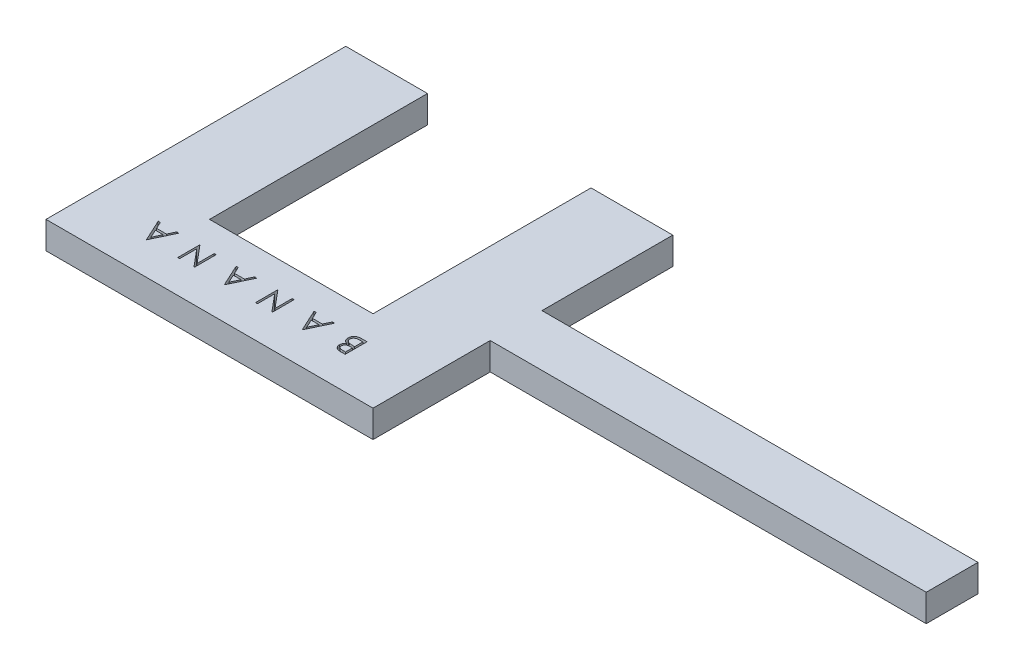
from build123d import *

# Parameters (mm, degrees)
BOSS_EXTRUDE1_DEPTH = 5
CUT_EXTRUDE1_DEPTH  = 3


with BuildPart() as part:
    # Sketch1 → Boss-Extrude1 (new body)
    with BuildSketch(Plane(origin=(0, 0, 0), x_dir=(1, 0, 0), z_dir=(0, 1, 0))):
        Polygon((0, -55), (60, -55), (60, -33.5), (140, -33.5), (140, -24), (60, -24), (60, 0), (45, 0), (45, -40), (15, -40), (15, 0), (0, 0), align=None)
    extrude(amount=BOSS_EXTRUDE1_DEPTH)

    # Sketch4 → Cut-Extrude1 (cut)
    # profile 1 of 6: a face of its own
    with BuildSketch(Plane(origin=(0, 5, 0), x_dir=(1, 0, 0), z_dir=(0, 1, 0))):
        Polygon((12.435897436, -49), (10.58974359, -45), (10.979967949, -45), (11.571314103, -46.282051282), (13.384615385, -46.282051282), (13.992788462, -45), (14.384615385, -45), (12.487179487, -49), align=None)
        Polygon((12.465544872, -48.220352564), (13.189903846, -46.692307692), (11.760416667, -46.692307692), align=None, mode=Mode.SUBTRACT)
    # profile 2 of 6: a face of its own
    with BuildSketch(Plane(origin=(0, 5, 0), x_dir=(1, 0, 0), z_dir=(0, 1, 0))):
        Polygon((21.225641026, -45), (21.225641026, -49), (21.150320513, -49), (18.507692308, -45.851762821), (18.507692308, -49), (18.148717949, -49), (18.148717949, -45), (18.230448718, -45), (20.866666667, -48.141025641), (20.866666667, -45), align=None)
    # profile 3 of 6: a face of its own
    with BuildSketch(Plane(origin=(0, 5, 0), x_dir=(1, 0, 0), z_dir=(0, 1, 0))):
        Polygon((26.733333333, -49), (24.887179487, -45), (25.277403846, -45), (25.86875, -46.282051282), (27.682051282, -46.282051282), (28.290224359, -45), (28.682051282, -45), (26.784615385, -49), align=None)
        Polygon((26.762980769, -48.220352564), (27.487339744, -46.692307692), (26.057852564, -46.692307692), align=None, mode=Mode.SUBTRACT)
    # profile 4 of 6: a face of its own
    with BuildSketch(Plane(origin=(0, 5, 0), x_dir=(1, 0, 0), z_dir=(0, 1, 0))):
        Polygon((35.523076923, -45), (35.523076923, -49), (35.44775641, -49), (32.805128205, -45.851762821), (32.805128205, -49), (32.446153846, -49), (32.446153846, -45), (32.527884615, -45), (35.164102564, -48.141025641), (35.164102564, -45), align=None)
    # profile 5 of 6: a face of its own
    with BuildSketch(Plane(origin=(0, 5, 0), x_dir=(1, 0, 0), z_dir=(0, 1, 0))):
        Polygon((41.030769231, -49), (39.184615385, -45), (39.574839744, -45), (40.166185897, -46.282051282), (41.979487179, -46.282051282), (42.587660256, -45), (42.979487179, -45), (41.082051282, -49), align=None)
        Polygon((41.060416667, -48.220352564), (41.784775641, -46.692307692), (40.355288462, -46.692307692), align=None, mode=Mode.SUBTRACT)
    # profile 6 of 6: a face of its own
    with BuildSketch(Plane(origin=(0, 5, 0), x_dir=(1, 0, 0), z_dir=(0, 1, 0))):
        with BuildLine():
            Line((48.897435897, -49), (48.116987179, -49))
            add(Edge.make_bspline(
                [(48.116987179, -49), (48.078782602, -48.999802304), (48.004732622, -48.999419121), (47.897061448, -48.993338284), (47.7961773, -48.985254385), (47.702258451, -48.97169408), (47.614693787, -48.957633832), (47.534372273, -48.936996754), (47.460621116, -48.91420235), (47.372061071, -48.879130066), (47.271577566, -48.824662366), (47.163576599, -48.743881592), (47.06969557, -48.647031967), (46.989868866, -48.536664179), (46.925806239, -48.415247106), (46.880046085, -48.285393075), (46.85064802, -48.149286724), (46.847662619, -48.055973237), (46.846153846, -48.008814103)],
                knots=[0, 0, 0, 0, 1.00128172, 1.940733171, 2.826250472, 3.653024905, 4.427672124, 5.149348099, 5.824709082, 6.450061444, 7.643590664, 8.808605388, 9.972104426, 11.165284501, 12.367876273, 13.557044126, 14.765369432, 16, 16, 16, 16], degree=3))
            add(Edge.make_bspline(
                [(46.846153846, -48.008814103), (46.847386233, -47.964634112), (46.84980799, -47.877816264), (46.873466598, -47.751260803), (46.909178693, -47.630411683), (46.960713415, -47.516433521), (47.026424516, -47.410327841), (47.106371945, -47.313904536), (47.201167683, -47.22905671), (47.272340847, -47.181837688), (47.30849359, -47.157852564)],
                knots=[0, 0, 0, 0, 1.044356178, 2.052258378, 3.035953355, 4.020338374, 5.002448483, 5.980768927, 6.974322109, 8, 8, 8, 8], degree=3))
            add(Edge.make_bspline(
                [(47.30849359, -47.157852564), (47.263049876, -47.140414673), (47.176104795, -47.107051668), (47.056302302, -47.047837808), (46.953049503, -46.983927334), (46.86501575, -46.9148518), (46.791249685, -46.838355693), (46.725535913, -46.756453592), (46.669766654, -46.666293122), (46.622183034, -46.56982802), (46.584489246, -46.467569127), (46.558324516, -46.360281463), (46.54173076, -46.249180208), (46.539560824, -46.173670002), (46.538461538, -46.135416667)],
                knots=[0, 0, 0, 0, 1.272200328, 2.434034374, 3.488177493, 4.442517805, 5.351202203, 6.260825393, 7.183200622, 8.11705787, 9.069326169, 10.026320267, 11.000137371, 12, 12, 12, 12], degree=3))
            add(Edge.make_bspline(
                [(46.538461538, -46.135416667), (46.539578041, -46.096368878), (46.541774791, -46.019541259), (46.557978943, -45.90667732), (46.585423547, -45.798823648), (46.623198448, -45.695262323), (46.672439932, -45.596599873), (46.731928763, -45.502060921), (46.803327906, -45.413046548), (46.883730364, -45.328265046), (46.973436376, -45.250736025), (47.072285382, -45.184110133), (47.177743985, -45.126562612), (47.291256316, -45.080297632), (47.412016926, -45.044080616), (47.540054106, -45.019040231), (47.675295151, -45.002100252), (47.768107642, -45.000711963), (47.815705128, -45)],
                knots=[0, 0, 0, 0, 0.978522333, 1.925270105, 2.85076145, 3.763600118, 4.682725947, 5.609499657, 6.557784645, 7.537954401, 8.534920712, 9.522742111, 10.520247711, 11.5409147, 12.58930695, 13.675078472, 14.807699069, 16, 16, 16, 16], degree=3))
            Line((47.815705128, -45), (48.897435897, -45))
            Line((48.897435897, -45), (48.897435897, -49))
        make_face()
        with BuildLine():
            Line((48.538461538, -48.58974359), (48.538461538, -47.307692308))
            Line((48.538461538, -47.307692308), (48.297275641, -47.307692308))
            add(Edge.make_bspline(
                [(48.297275641, -47.307692308), (48.262019557, -47.308145559), (48.193897619, -47.309021333), (48.094984144, -47.311609081), (48.003398634, -47.318537578), (47.918825519, -47.32586562), (47.841831582, -47.337149257), (47.772159281, -47.350957405), (47.709182048, -47.365432661), (47.636590639, -47.390121207), (47.554259533, -47.426226355), (47.46710675, -47.483630694), (47.388665327, -47.550092509), (47.323955681, -47.628926607), (47.270082552, -47.714060303), (47.233811866, -47.806128442), (47.208522595, -47.901958331), (47.206271259, -47.968047579), (47.205128205, -48.001602564)],
                knots=[0, 0, 0, 0, 1.156584208, 2.234756387, 3.244705828, 4.168772894, 5.018724976, 5.795346628, 6.498686023, 7.135894168, 8.308330183, 9.43588092, 10.547699294, 11.667188675, 12.76860303, 13.837480448, 14.902040606, 16, 16, 16, 16], degree=3))
            add(Edge.make_bspline(
                [(47.205128205, -48.001602564), (47.205685691, -48.023816697), (47.20677926, -48.067392143), (47.217088766, -48.130879067), (47.231315761, -48.191293527), (47.25477962, -48.247006859), (47.282578229, -48.299975385), (47.318209405, -48.34852593), (47.359295429, -48.393973734), (47.407196584, -48.435100612), (47.461717059, -48.472297499), (47.524583935, -48.503262131), (47.594088014, -48.530780023), (47.671678673, -48.551639229), (47.755810377, -48.569748341), (47.847766678, -48.581167846), (47.946993383, -48.588503916), (48.015743783, -48.589321148), (48.051282051, -48.58974359)],
                knots=[0, 0, 0, 0, 0.911412742, 1.787835618, 2.63643285, 3.453173233, 4.262886967, 5.08783453, 5.918594724, 6.773969545, 7.67442701, 8.62112486, 9.645634318, 10.739428598, 11.916091468, 13.177237585, 14.540865421, 16, 16, 16, 16], degree=3))
            Line((48.051282051, -48.58974359), (48.538461538, -48.58974359))
        make_face(mode=Mode.SUBTRACT)
        with BuildLine():
            Line((48.538461538, -46.897435897), (48.538461538, -45.41025641))
            Line((48.538461538, -45.41025641), (48.02724359, -45.41025641))
            add(Edge.make_bspline(
                [(48.02724359, -45.41025641), (47.99065419, -45.41073715), (47.920132945, -45.411663713), (47.818234921, -45.41386232), (47.724292741, -45.422019142), (47.63752424, -45.429839399), (47.558330886, -45.442615415), (47.485942388, -45.454987006), (47.422012134, -45.473192413), (47.347210045, -45.498243376), (47.26354466, -45.538278135), (47.172178111, -45.597152678), (47.091703188, -45.66886621), (47.023425854, -45.751440271), (46.966656245, -45.84029687), (46.927382886, -45.935610894), (46.901935986, -46.034198698), (46.898938947, -46.101609423), (46.897435897, -46.135416667)],
                knots=[0, 0, 0, 0, 1.16016216, 2.236059617, 3.229676189, 4.14889023, 4.996733752, 5.772278665, 6.474820656, 7.101410824, 8.271817372, 9.403828207, 10.537358096, 11.673541442, 12.791884111, 13.865947414, 14.929748409, 16, 16, 16, 16], degree=3))
            add(Edge.make_bspline(
                [(46.897435897, -46.135416667), (46.897742716, -46.156555083), (46.898351404, -46.198490951), (46.907919371, -46.260062814), (46.921197263, -46.320001273), (46.940765146, -46.377492166), (46.964436964, -46.433525476), (46.995666123, -46.486277982), (47.030892383, -46.537995275), (47.085452532, -46.604147419), (47.165892911, -46.679445819), (47.280241748, -46.752246439), (47.409533392, -46.811908817), (47.503528097, -46.837131085), (47.552083333, -46.850160256)],
                knots=[0, 0, 0, 0, 0.723354195, 1.435040621, 2.129761981, 2.824182007, 3.512608497, 4.209435533, 4.920062464, 5.654614313, 7.143585817, 8.671381114, 10.280521501, 12, 12, 12, 12], degree=3))
            add(Edge.make_bspline(
                [(47.552083333, -46.850160256), (47.571545139, -46.854109189), (47.613742348, -46.86267129), (47.682551361, -46.871703561), (47.76137005, -46.879805803), (47.849861531, -46.88564168), (47.948377746, -46.891906393), (48.056887045, -46.894256042), (48.175466139, -46.897123913), (48.257743237, -46.897329242), (48.300480769, -46.897435897)],
                knots=[0, 0, 0, 0, 0.634452549, 1.375623993, 2.216454381, 3.166361212, 4.209414599, 5.370755378, 6.634280627, 8, 8, 8, 8], degree=3))
            Line((48.300480769, -46.897435897), (48.538461538, -46.897435897))
        make_face(mode=Mode.SUBTRACT)
    extrude(amount=-CUT_EXTRUDE1_DEPTH, mode=Mode.SUBTRACT)


solid = part.part
